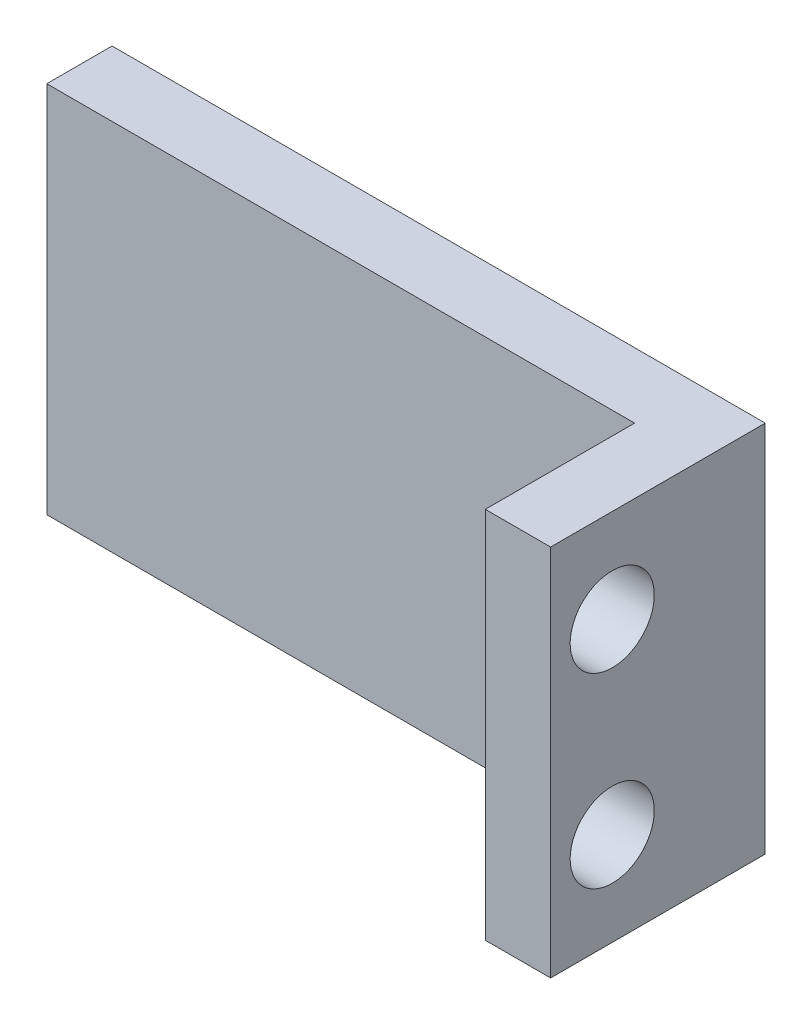
from build123d import *

# Parameters (mm, degrees)
SKETCH_1_W          = 35
SKETCH_1_H          = 20
EXTRUDE_1_DEPTH     = 3.5
SKETCH_2_W          = 3.5
SKETCH_2_H          = 20
EXTRUDE_2_DEPTH     = 8
SKETCH_3_R          = 2.255
CUT_EXTRUDE_1_DEPTH = 8


with BuildPart() as part:
    # 草图1 → 凸台-拉伸1 (new body)
    with BuildSketch(Plane.XY):
        Rectangle(SKETCH_1_W, SKETCH_1_H)
    extrude(amount=EXTRUDE_1_DEPTH)

    # 草图2 → 凸台-拉伸2 (add)
    with BuildSketch(Plane.XY.offset(3.5)):
        with Locations((15.75, 0)):
            Rectangle(SKETCH_2_W, SKETCH_2_H)
    extrude(amount=EXTRUDE_2_DEPTH)

    # 草图3 → 切除-拉伸1 (cut)
    with BuildSketch(Plane.ZY.offset(-14)):
        with Locations((8.2, 5)):
            Circle(SKETCH_3_R)
        with Locations((8.2, -5)):
            Circle(SKETCH_3_R)
    extrude(amount=-CUT_EXTRUDE_1_DEPTH, mode=Mode.SUBTRACT)


solid = part.part
